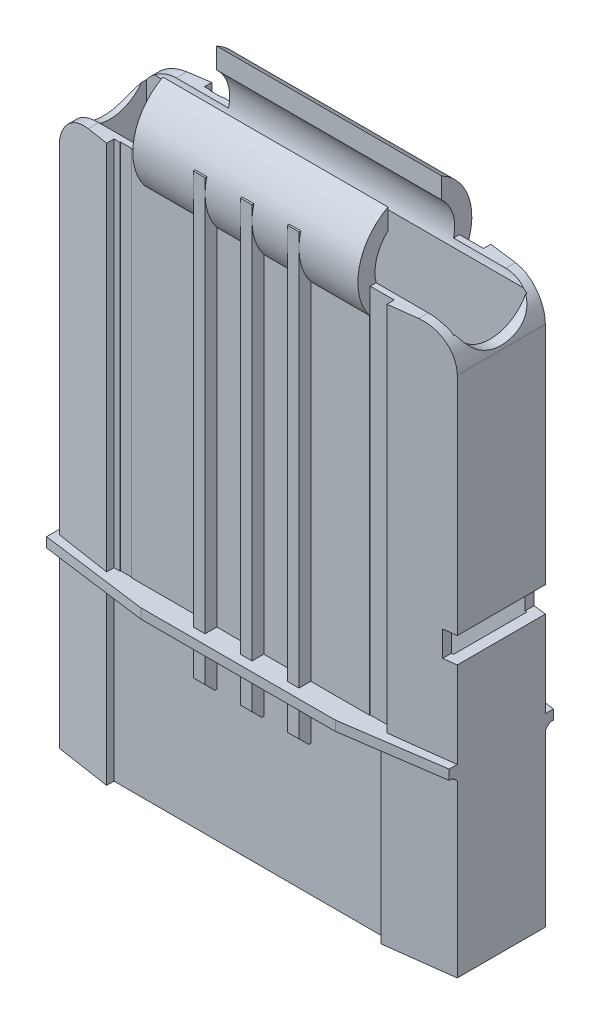
from build123d import *

# Parameters (mm, degrees)
BOSS_EXTRUDE1_DEPTH = 35.8
BOSS_EXTRUDE2_DEPTH = 2
BOSS_EXTRUDE3_DEPTH = 80.75
BOSS_EXTRUDE4_REACH = 146.956
CUT_EXTRUDE1_REACH  = 153.027
CUT_EXTRUDE2_REACH  = 138.917
SKETCH8_W           = 77.8
SKETCH8_H           = 15
CUT_EXTRUDE3_DEPTH  = 110.7
SKETCH9_W           = 22
SKETCH9_H           = 5.2
CUT_EXTRUDE4_DEPTH  = 2.65
SKETCH10_W          = 2.4
SKETCH10_H          = 2.4
BOSS_EXTRUDE5_DEPTH = 9
CHAMFER1_SIZE       = 2
CHAMFER2_SIZE       = 0.9
SKETCH11_W          = 4.9
SKETCH11_H          = 2.364017575
SKETCH11_W_2        = 2.4
CUT_EXTRUDE5_DEPTH  = 75.9
CUT_EXTRUDE8_DEPTH  = 9


with BuildPart() as part:
    # Sketch1 → Boss-Extrude1 (new body)
    with BuildSketch(Plane(origin=(0, 0, 0), x_dir=(1, 0, 0), z_dir=(0, 1, 0))):
        Polygon((-46.566712818, 9), (-35.138647257, 10.75), (-35.138647257, 9.25), (20.961352743, 9.25), (20.961352743, 10.75), (34.783286571, 9), (34.783286571, -9), (20.961352743, -10.75), (20.961352743, -9.25), (-35.138647257, -9.25), (-35.138647257, -10.75), (-46.566712818, -9), align=None)
    extrude(amount=BOSS_EXTRUDE1_DEPTH)

    # Sketch2 → Boss-Extrude2 (add)
    with BuildSketch(Plane(origin=(0, 35.8, 0), x_dir=(1, 0, 0), z_dir=(0, 1, 0))):
        Polygon((-25.316713429, 13.6), (14.483286571, 13.6), (34.783286571, 10.65), (34.783286571, -10.65), (14.483286571, -13.6), (-25.316713429, -13.6), (-47.516713429, -10.65), (-47.516713429, 10.65), align=None)
    extrude(amount=BOSS_EXTRUDE2_DEPTH)

    # Sketch3 → Boss-Extrude3 (add)
    with BuildSketch(Plane(origin=(0, 37.8, 0), x_dir=(1, 0, 0), z_dir=(0, 1, 0))):
        Polygon((20.961352743, 9.25), (5.083286571, 9.25), (5.083286571, 11.65), (2.683286571, 11.65), (2.683286571, 9.25), (-4.516713429, 9.25), (-4.516713429, 11.65), (-6.916713429, 11.65), (-6.916713429, 9.25), (-14.116713429, 9.25), (-14.116713429, 11.65), (-16.516713429, 11.65), (-16.516713429, 9.25), (-35.138647257, 9.25), (-35.138647257, 10.75), (-46.566712818, 9), (-46.566712818, -9), (-35.138647257, -10.75), (-35.138647257, -9.25), (-16.516713429, -9.25), (-16.516713429, -11.65), (-14.116713429, -11.65), (-14.116713429, -9.25), (-6.916713429, -9.25), (-6.916713429, -11.65), (-4.516713429, -11.65), (-4.516713429, -9.25), (2.683286571, -9.25), (2.683286571, -11.65), (5.083286571, -11.65), (5.083286571, -9.25), (20.961352743, -9.25), (20.961352743, -10.75), (34.783286571, -9), (34.783286571, 9), (20.961352743, 10.75), align=None)
    extrude(amount=BOSS_EXTRUDE3_DEPTH)

    # Boss-Extrude4: up to this face of the body (flat: up to its plane)
    boss_extrude4_end = Plane(part.part.faces().sort_by_distance((-46.566712818, 78.175, 0))[0])
    # Sketch5 → Boss-Extrude4 (add, up to the picked face)
    with BuildSketch(Plane(origin=(34.783286571, 0, 0), x_dir=(0, 0, -1), z_dir=(1, 0, 0)), mode=Mode.PRIVATE) as boss_extrude4_sk1:
        with BuildLine():
            Line((-5.5, 125.9), (5.5, 125.9))
            ThreePointArc((5.5, 125.9), (0, 103.980019474), (-5.5, 125.9))
        make_face()
    boss_extrude4_tool1 = split(extrude(boss_extrude4_sk1.sketch, amount=-BOSS_EXTRUDE4_REACH, mode=Mode.PRIVATE), bisect_by=boss_extrude4_end, keep=Keep.BOTH, mode=Mode.PRIVATE)
    add(boss_extrude4_tool1.solids().sort_by(Axis((34.783287, 115.363482, 0), (-1, 0, 0)))[0])

    # Sketch6 → Cut-Extrude1 (cut, up to next)
    with BuildSketch(Plane(origin=(34.783286571, 0, 0), x_dir=(0, 0, -1), z_dir=(1, 0, 0)), mode=Mode.PRIVATE) as cut_extrude1_sk1:
        with BuildLine():
            Line((-5.5, 125.9), (-5.5, 121.644377295))
            ThreePointArc((-5.5, 121.644377295), (0, 107.480019474), (5.5, 121.644377295))
            Line((5.5, 121.644377295), (5.5, 125.9))
            Line((5.5, 125.9), (-5.5, 125.9))
        make_face()
    cut_extrude1_tool1 = extrude(cut_extrude1_sk1.sketch, amount=-CUT_EXTRUDE1_REACH, mode=Mode.PRIVATE) & part.part
    add(cut_extrude1_tool1.solids().sort_by_distance((34.783287, 116.759001, 0))[0], mode=Mode.SUBTRACT)

    # Sketch7 → Cut-Extrude2 (cut, up to next)
    with BuildSketch(Plane(origin=(0, 0, -11.65), x_dir=(-1, 0, 0), z_dir=(0, 0, -1)), mode=Mode.PRIVATE) as cut_extrude2_sk1:
        with BuildLine():
            Line((-34.783286571, 125.9), (-17.108286571, 125.9))
            Line((-17.108286571, 125.9), (-17.108286571, 113.7))
            Line((-17.108286571, 113.7), (-27.783286571, 113.7))
            ThreePointArc((-27.783286571, 113.7), (-32.73303404, 111.649747468), (-34.783286571, 106.7))
            Line((-34.783286571, 106.7), (-34.783286571, 113.7))
            Line((-34.783286571, 113.7), (-34.783286571, 125.9))
        make_face()
    cut_extrude2_tool1 = extrude(cut_extrude2_sk1.sketch, amount=-CUT_EXTRUDE2_REACH, mode=Mode.PRIVATE) & part.part
    # Sketch7 → Cut-Extrude2 (cut, up to next)
    with BuildSketch(Plane(origin=(0, 0, -11.65), x_dir=(-1, 0, 0), z_dir=(0, 0, -1)), mode=Mode.PRIVATE) as cut_extrude2_sk2:
        with BuildLine():
            Line((28.891713429, 125.9), (46.566712818, 125.9))
            Line((46.566712818, 125.9), (46.566712818, 113.7))
            Line((46.566712818, 113.7), (46.566712818, 106.7))
            ThreePointArc((46.566712818, 106.7), (44.516460286, 111.649747468), (39.566712818, 113.7))
            Line((39.566712818, 113.7), (28.891713429, 113.7))
            Line((28.891713429, 113.7), (28.891713429, 125.9))
        make_face()
    cut_extrude2_tool2 = extrude(cut_extrude2_sk2.sketch, amount=-CUT_EXTRUDE2_REACH, mode=Mode.PRIVATE) & part.part
    add(cut_extrude2_tool1.solids().sort_by_distance((26.284008, 119.443661, -11.65))[0], mode=Mode.SUBTRACT)
    add(cut_extrude2_tool2.solids().sort_by_distance((-38.067434, 119.443661, -11.65))[0], mode=Mode.SUBTRACT)

    # Sketch8 → Cut-Extrude3 (cut)
    with BuildSketch(Plane(origin=(0, 113.7, 0), x_dir=(1, 0, 0), z_dir=(0, 1, 0))):
        with Locations((-6.366713429, 0)):
            Rectangle(SKETCH8_W, SKETCH8_H)
    extrude(amount=-CUT_EXTRUDE3_DEPTH, mode=Mode.SUBTRACT)

    # Sketch9 → Cut-Extrude4 (cut)
    with BuildSketch(Plane(origin=(34.783286571, 0, 0), x_dir=(0, 0, -1), z_dir=(1, 0, 0))):
        with Locations((0, 58.02)):
            Rectangle(SKETCH9_W, SKETCH9_H)
    extrude(amount=-CUT_EXTRUDE4_DEPTH, mode=Mode.SUBTRACT)

    # Sketch10 → Boss-Extrude5 (add)
    with BuildSketch(Plane.XZ.offset(-35.8)):
        with Locations((-15.316713429, 10.45)):
            Rectangle(SKETCH10_W, SKETCH10_H)
        with Locations((-5.716713429, 10.45)):
            Rectangle(SKETCH10_W, SKETCH10_H)
        with Locations((3.883286571, 10.45)):
            Rectangle(SKETCH10_W, SKETCH10_H)
        with Locations((-15.316713429, -10.45)):
            Rectangle(SKETCH10_W, SKETCH10_H)
        with Locations((-5.716713429, -10.45)):
            Rectangle(SKETCH10_W, SKETCH10_H)
        with Locations((3.883286571, -10.45)):
            Rectangle(SKETCH10_W, SKETCH10_H)
    extrude(amount=BOSS_EXTRUDE5_DEPTH)

    # Chamfer1
    chamfer1_edges = [part.edges().sort_by_distance(p)[0] for p in [
        (-15.316713429, 26.8, 11.65),
        (-5.716713429, 26.8, 11.65),
        (3.883286571, 26.8, 11.65),
        (-15.316713429, 26.8, -11.65),
        (-5.716713429, 26.8, -11.65),
        (3.883286571, 26.8, -11.65),
    ]]
    chamfer(chamfer1_edges, length=CHAMFER1_SIZE)

    # Chamfer2
    chamfer2_edges = [part.edges().sort_by_distance(p)[0] for p in [
        (27.872319657, 35.8, -9.875),
        (27.872319657, 35.8, 9.875),
        (-40.852680038, 35.8, 9.875),
        (-40.852680038, 35.8, -9.875),
        (-46.566712818, 35.8, 0),
    ]]
    chamfer(chamfer2_edges, length=CHAMFER2_SIZE)

    # Sketch11 → Cut-Extrude5 (cut)
    with BuildSketch(Plane(origin=(0, 113.7, 0), x_dir=(1, 0, 0), z_dir=(0, 1, 0))):
        with Locations((19.558286571, 10.307008787)):
            Rectangle(SKETCH11_W, SKETCH11_H)
        with Locations((-32.751713429, 10.307008787)):
            Rectangle(SKETCH11_W_2, SKETCH11_H)
        with Locations((19.558286571, -10.307008787)):
            Rectangle(SKETCH11_W, SKETCH11_H)
        with Locations((-32.751713429, -10.307008787)):
            Rectangle(SKETCH11_W_2, SKETCH11_H)
    extrude(amount=-CUT_EXTRUDE5_DEPTH, mode=Mode.SUBTRACT)

    # Sketch12 → Cut-Extrude8 (cut)
    with BuildSketch(Plane(origin=(0, 113.7, 0), x_dir=(1, 0, 0), z_dir=(0, 1, 0))):
        Polygon((-35.138647257, 10.75), (-46.38936057, 9.027158265), (-46.38936057, 11.562386164), (-28.891713429, 11.65), (-28.891713429, 9.25), (-35.138647257, 9.25), align=None)
        Polygon((-46.38936057, -9.027158265), (-35.138647257, -10.75), (-35.138647257, -9.25), (-28.891713429, -9.25), (-28.891713429, -12.366008702), (-46.38936057, -12.366008702), align=None)
        Polygon((34.60730254, 9.022281401), (22.008286571, 10.617447332), (22.008286571, 9.125), (17.108286571, 9.125), (17.108286571, 11.65), (17.108286571, 15.14091914), (34.60730254, 15.14091914), align=None)
        Polygon((22.008286571, -10.617447332), (34.60730254, -9.022281401), (34.60730254, -11.65), (17.108286571, -11.65), (17.108286571, -9.125), (22.008286571, -9.125), align=None)
    extrude(amount=-CUT_EXTRUDE8_DEPTH, mode=Mode.SUBTRACT)


solid = part.part
